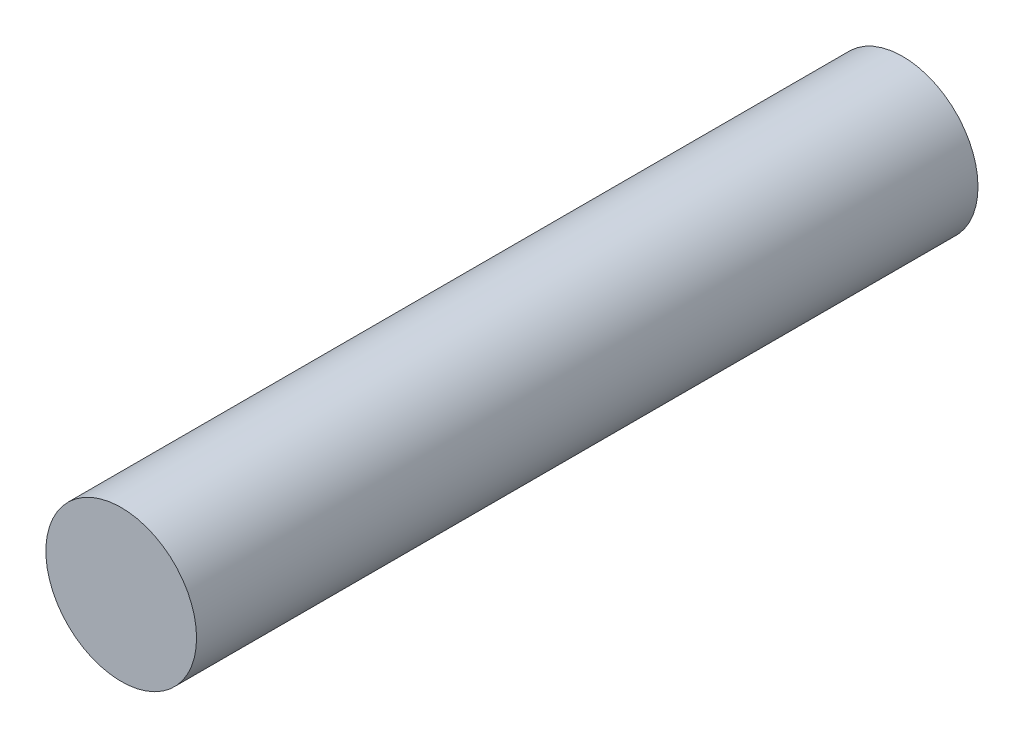
from build123d import *

# Parameters (mm, degrees)
SKETCH1_R           = 1.35
BOSS_EXTRUDE1_DEPTH = 14


with BuildPart() as part:
    # Sketch1 → Boss-Extrude1 (new body)
    with BuildSketch(Plane.XY):
        Circle(SKETCH1_R)
    extrude(amount=BOSS_EXTRUDE1_DEPTH)


solid = part.part
